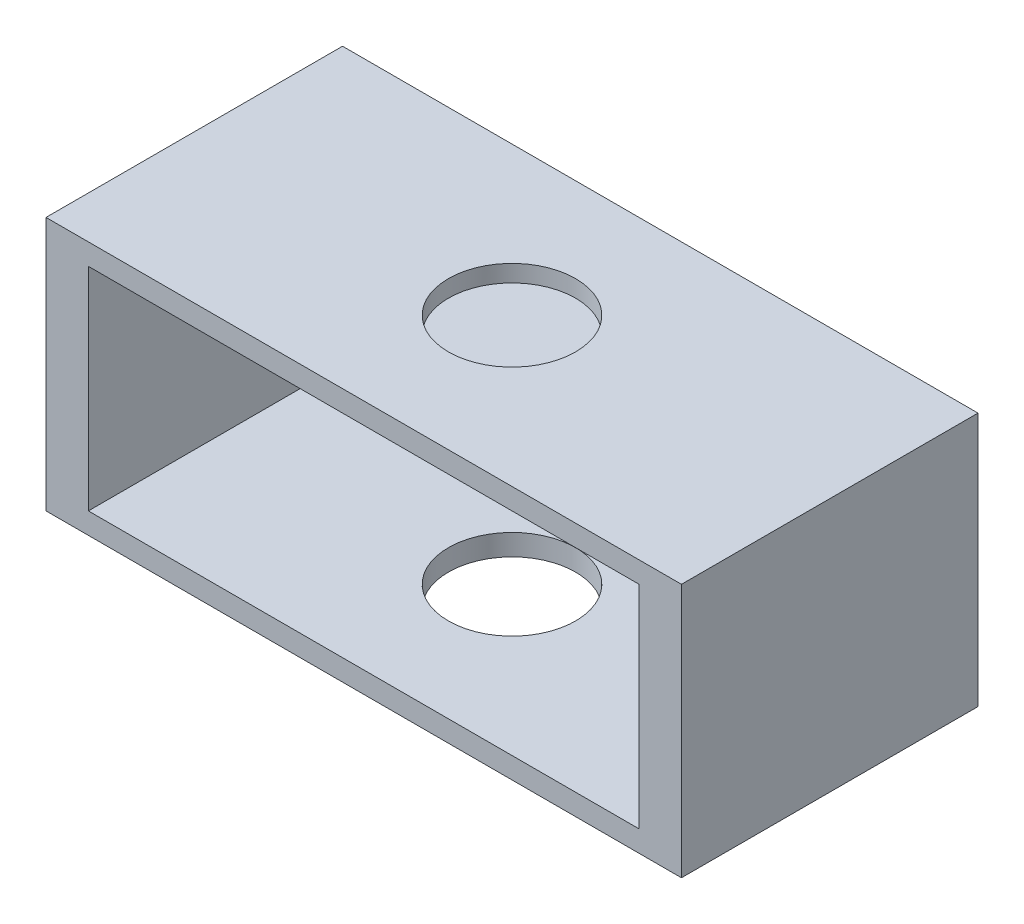
from build123d import *

# Parameters (mm, degrees)
SKETCH_1_W      = 30
SKETCH_1_H      = 14
SKETCH_1_R      = 3
EXTRUDE_1_DEPTH = 1
SKETCH_2_W      = 2
SKETCH_2_H      = 14
EXTRUDE_2_DEPTH = 10
SKETCH_3_W      = 30
SKETCH_3_H      = 14
SKETCH_3_R      = 3
EXTRUDE_3_DEPTH = 1
SKETCH_4_R      = 3
EXTRUDE_4_DEPTH = 0.2


with BuildPart() as part:
    # Эскиз1 → Бобышка-Вытянуть1 (new body)
    with BuildSketch(Plane(origin=(0, 0, 0), x_dir=(1, 0, 0), z_dir=(0, 1, 0))):
        Rectangle(SKETCH_1_W, SKETCH_1_H)
        with Locations(Location((0, 0, 0), (0, 0, 270))):
            Circle(SKETCH_1_R, mode=Mode.SUBTRACT)
    extrude(amount=EXTRUDE_1_DEPTH)

    # Эскиз2 → Бобышка-Вытянуть2 (add)
    with BuildSketch(Plane(origin=(0, 1, 0), x_dir=(1, 0, 0), z_dir=(0, 1, 0))):
        with Locations((-14, 0)):
            Rectangle(SKETCH_2_W, SKETCH_2_H)
        with Locations((14, 0)):
            Rectangle(SKETCH_2_W, SKETCH_2_H)
    extrude(amount=EXTRUDE_2_DEPTH)

    # Эскиз3 → Бобышка-Вытянуть3 (add)
    with BuildSketch(Plane(origin=(0, 11, 0), x_dir=(1, 0, 0), z_dir=(0, 1, 0))):
        Rectangle(SKETCH_3_W, SKETCH_3_H)
        with Locations(Location((0, 0, 0), (0, 0, 270))):
            Circle(SKETCH_3_R, mode=Mode.SUBTRACT)
    extrude(amount=EXTRUDE_3_DEPTH)

    # Эскиз4 → Бобышка-Вытянуть4 (add)
    with BuildSketch(Plane.XZ.offset(-11)):
        with Locations(Location((0, 0, 0), (0, 0, 270))):
            Circle(SKETCH_4_R)
    extrude(amount=-EXTRUDE_4_DEPTH)


solid = part.part
